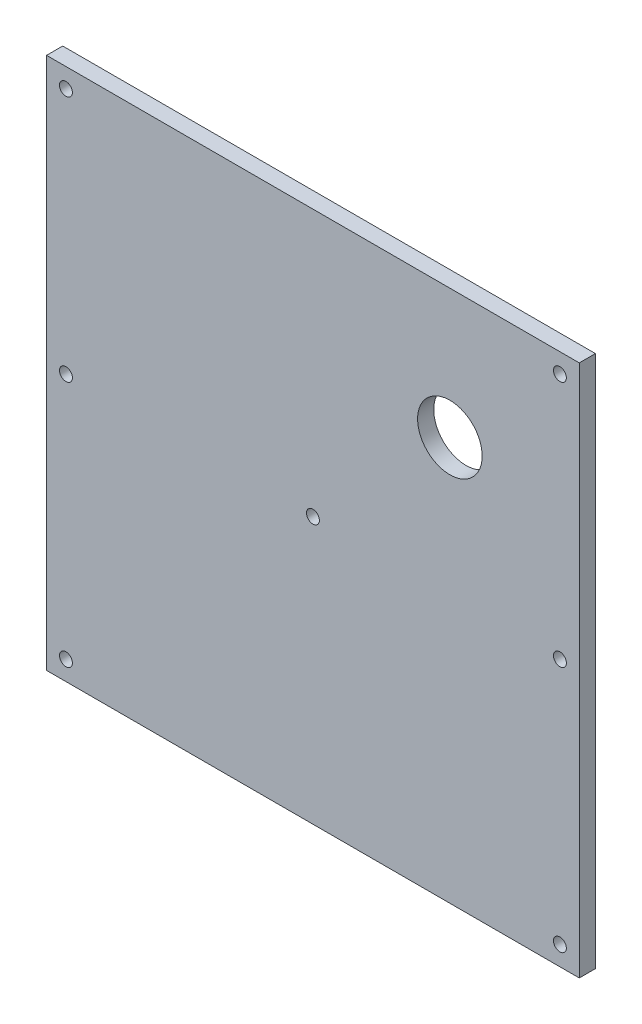
from build123d import *

# Parameters (mm, degrees)
ESQUISSE1_W        = 165
ESQUISSE1_H        = 165
ESQUISSE1_R        = 2
ESQUISSE1_R_2      = 10
BOSS_EXTRU_1_DEPTH = 5
BOSS_EXTRU_2_DEPTH = 5


with BuildPart() as part:
    # Esquisse1 → Boss.-Extru.1 (new body)
    with BuildSketch(Plane.XY):
        Rectangle(ESQUISSE1_W, ESQUISSE1_H)
        with Locations((-76.5, 76.5)):
            Circle(ESQUISSE1_R, mode=Mode.SUBTRACT)
        with Locations((-76.5, 0)):
            Circle(ESQUISSE1_R, mode=Mode.SUBTRACT)
        with Locations((-76.5, -76.5)):
            Circle(ESQUISSE1_R, mode=Mode.SUBTRACT)
        with Locations((76.5, -76.5)):
            Circle(ESQUISSE1_R, mode=Mode.SUBTRACT)
        with Locations((76.5, 0)):
            Circle(ESQUISSE1_R, mode=Mode.SUBTRACT)
        with Locations((76.5, 76.5)):
            Circle(ESQUISSE1_R, mode=Mode.SUBTRACT)
        Circle(ESQUISSE1_R, mode=Mode.SUBTRACT)
        with Locations((42.41686608, 42.443425371)):
            Circle(ESQUISSE1_R_2, mode=Mode.SUBTRACT)
    extrude(amount=BOSS_EXTRU_1_DEPTH)

    # Esquisse2 → Boss.-Extru.2 (add)
    with BuildSketch(Plane(origin=(0, 0, 0), x_dir=(-1, 0, 0), z_dir=(0, 0, -1))):
        with BuildLine():
            Line((4, 77.5), (4, 6.34428877))
            ThreePointArc((4, 6.34428877), (3.032395143, 6.859634079), (2, 7.228416147))
            Line((2, 7.228416147), (2, 12.228416147))
            Line((2, 12.228416147), (-2, 12.228416147))
            Line((-2, 12.228416147), (-2, 7.228416147))
            ThreePointArc((-2, 7.228416147), (-3.032395143, 6.859634079), (-4, 6.34428877))
            Line((-4, 6.34428877), (-4, 77.143871387))
            Line((-4, 77.143871387), (-2, 77.143871387))
            Line((-2, 77.143871387), (-2, 72.5))
            Line((-2, 72.5), (2, 72.5))
            Line((2, 72.5), (2, 77.491359298))
            Line((2, 77.491359298), (4, 77.5))
        make_face()
    extrude(amount=BOSS_EXTRU_2_DEPTH)


solid = part.part
